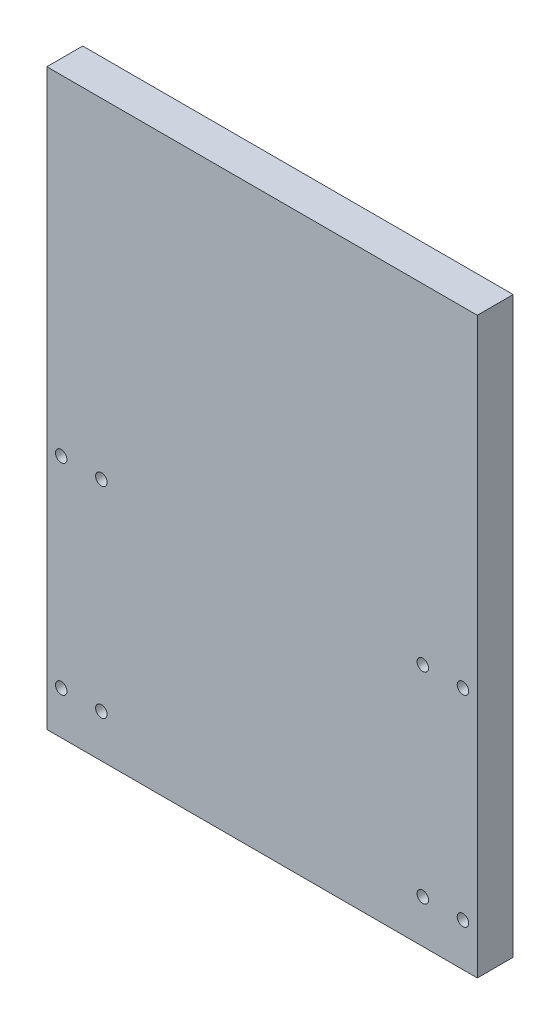
from build123d import *

# Parameters (mm, degrees)
SKETCH1_W           = 300
SKETCH1_H           = 400
SKETCH1_R           = 4
BOSS_EXTRUDE1_DEPTH = 25


with BuildPart() as part:
    # Sketch1 → Boss-Extrude1 (new body)
    with BuildSketch(Plane.XY):
        Rectangle(SKETCH1_W, SKETCH1_H)
        with Locations((-112, -170)):
            Circle(SKETCH1_R, mode=Mode.SUBTRACT)
        with Locations((-140, -170)):
            Circle(SKETCH1_R, mode=Mode.SUBTRACT)
        with Locations(Location((112, -170, 0), (0, 0, 180))):
            Circle(SKETCH1_R, mode=Mode.SUBTRACT)
        with Locations(Location((140, -170, 0), (0, 0, 180))):
            Circle(SKETCH1_R, mode=Mode.SUBTRACT)
        with Locations((112, -30)):
            Circle(SKETCH1_R, mode=Mode.SUBTRACT)
        with Locations((140, -30)):
            Circle(SKETCH1_R, mode=Mode.SUBTRACT)
        with Locations(Location((-112, -30, 0), (0, 0, 180))):
            Circle(SKETCH1_R, mode=Mode.SUBTRACT)
        with Locations(Location((-140, -30, 0), (0, 0, 180))):
            Circle(SKETCH1_R, mode=Mode.SUBTRACT)
    extrude(amount=-BOSS_EXTRUDE1_DEPTH)


solid = part.part
